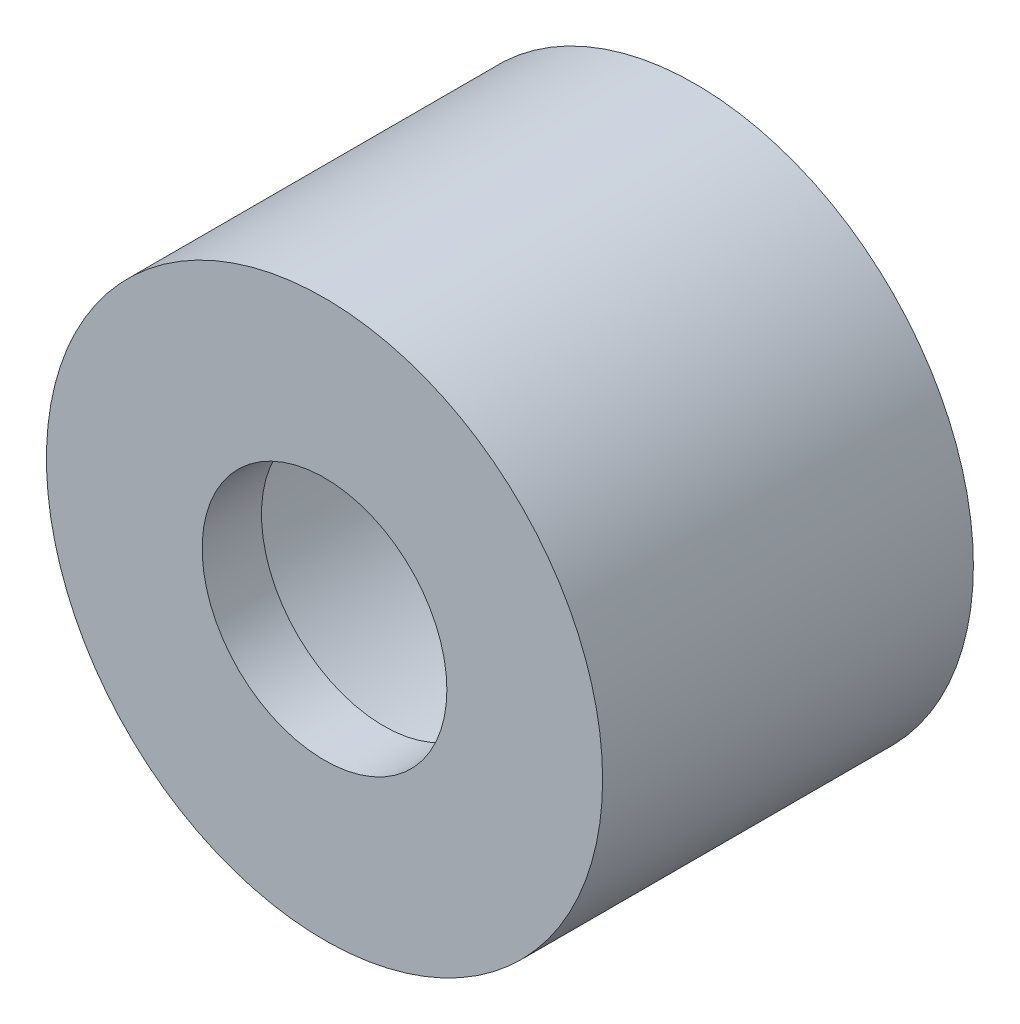
from build123d import *

# Parameters (mm, degrees)
SZKIC1_W                    = 10
SZKIC1_H                    = 7.5
SZKIC3_R                    = 5.625
DODANIE_WYCI_GNI_CIE1_DEPTH = 3.75


with BuildPart() as part:
    # Szkic1 → Obrót1 (revolve)
    with BuildSketch(Plane(origin=(0, 0, 0), x_dir=(0, 0, -1), z_dir=(1, 0, 0)), mode=Mode.PRIVATE) as obr_t1_sk:
        with Locations((-5, 3.75)):
            Rectangle(SZKIC1_W, SZKIC1_H)
    revolve(obr_t1_sk.sketch.rotate(Axis((0, 0, 0), (0, 0, 1)), 270), axis=Axis((0, 0, 0), (0, 0, 1)))

    # Szkic2 → Wycięcie-obrót1 (revolve, cut)
    with BuildSketch(Plane(origin=(0, 0, 0), x_dir=(0, 0, -1), z_dir=(1, 0, 0)), mode=Mode.PRIVATE) as wyci_cie_obr_t1_sk:
        Polygon((-10, 0), (-10, 3.3), (-8.4, 3.3), (-8.4, 5.5), (0, 5.5), (0, 0), align=None)
    revolve(wyci_cie_obr_t1_sk.sketch.rotate(Axis((0, 0, 0), (0, 0, 1)), 270), axis=Axis((0, 0, 0), (0, 0, 1)), mode=Mode.SUBTRACT)


with BuildPart() as body_2:
    # Szkic3 → Dodanie-wyciągnięcie1 (new body)
    with BuildSketch(Plane(origin=(0, 0, 0), x_dir=(0, 0, -1), z_dir=(1, 0, 0))):
        Circle(SZKIC3_R)
    extrude(amount=DODANIE_WYCI_GNI_CIE1_DEPTH)

    # Usuń ścianę1: 1 face struck out; the rest of the skin is kept as a surface, the solid goes
    usu_cian_1_1_drop = [body_2.part.faces().sort_by_distance(Vector(p))[0] for p in ((3.75, 0, 0),)]
    usu_cian_1_1 = Shell(body_2.part.faces() - usu_cian_1_1_drop)


solid = part.part
